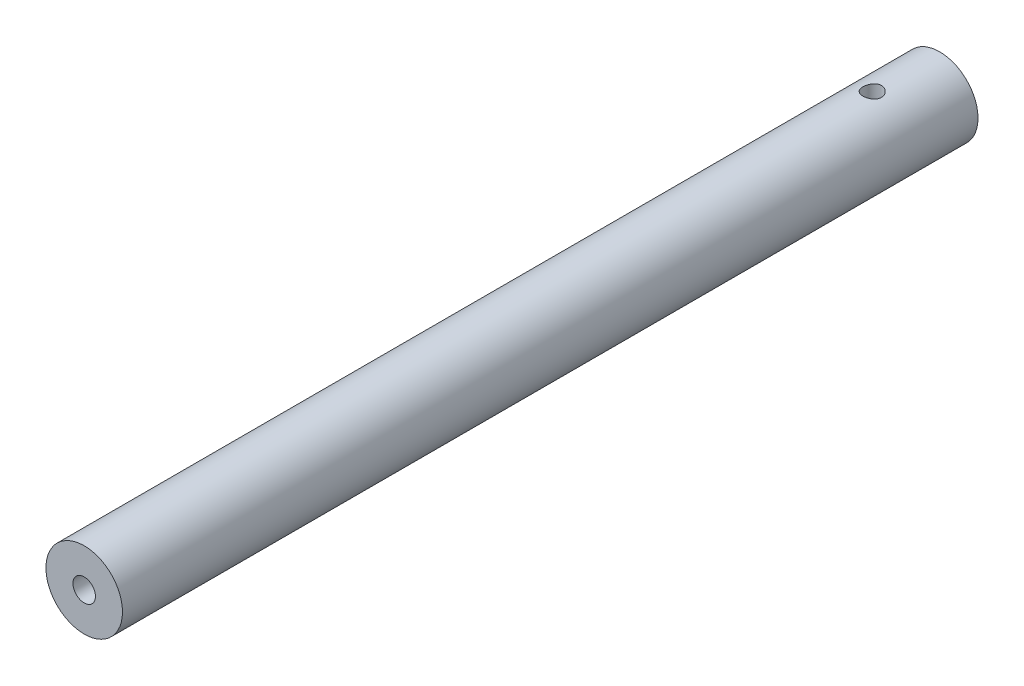
from build123d import *

# Parameters (mm, degrees)
SKETCH1_R               = 10.795
SKETCH1_R_2             = 3.175
BOSS_EXTRUDE1_DEPTH     = 241.3
CUT_EXTRUDE1_DEPTH      = 254
CUT_EXTRUDE1_DEPTH_BACK = 254
SKETCH2_R               = 2.6035


with BuildPart() as part:
    # Sketch1 → Boss-Extrude1 (new body)
    with BuildSketch(Plane.XY):
        Circle(SKETCH1_R)
        Circle(SKETCH1_R_2, mode=Mode.SUBTRACT)
    extrude(amount=BOSS_EXTRUDE1_DEPTH)

    # Sketch2 → Cut-Extrude1 (cut, two sides: drawn at the far end of the back side and taken through both)
    with BuildSketch(Plane(origin=(0, 0, 0), x_dir=(1, 0, 0), z_dir=(0, 1, 0)).offset(-CUT_EXTRUDE1_DEPTH_BACK)):
        with Locations((0, -19.05)):
            Circle(SKETCH2_R)
    extrude(amount=CUT_EXTRUDE1_DEPTH + CUT_EXTRUDE1_DEPTH_BACK, mode=Mode.SUBTRACT)


solid = part.part
